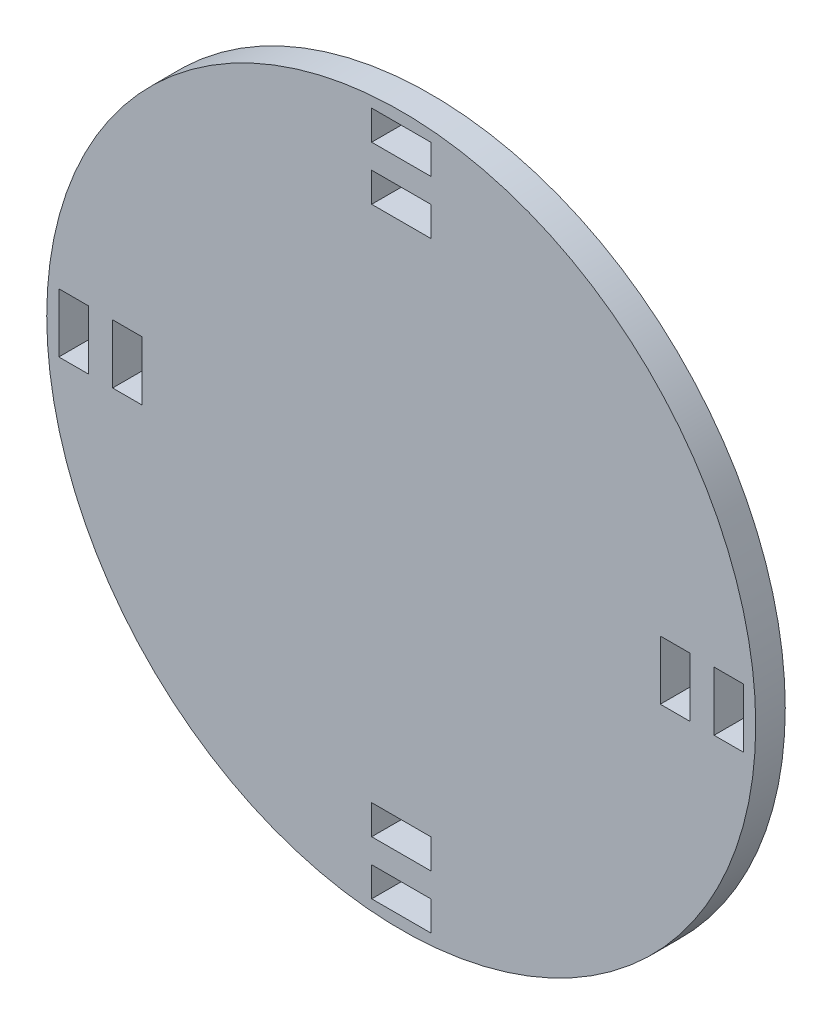
from build123d import *

# Parameters (mm, degrees)
SKETCH1_R           = 76.2
SKETCH1_R_2         = 53.086
BOSS_EXTRUDE2_DEPTH = 6.35
CUT_EXTRUDE1_REACH  = 109.95
SKETCH2_W           = 12.7
SKETCH2_H           = 6.35
CIRPATTERN1_COUNT   = 4
BOSS_EXTRUDE3_START = -6.35
SKETCH3_R           = 53.086
BOSS_EXTRUDE3_DEPTH = 6.35


with BuildPart() as part:
    # Sketch1 → Boss-Extrude2 (new body)
    with BuildSketch(Plane.XY):
        Circle(SKETCH1_R)
        Circle(SKETCH1_R_2, mode=Mode.SUBTRACT)
    extrude(amount=BOSS_EXTRUDE2_DEPTH)

    # Sketch2 → Cut-Extrude1 (cut, up to next)
    with BuildSketch(Plane.XY.offset(6.35), mode=Mode.PRIVATE) as cut_extrude1_sk1:
        with Locations((0, 70.4215)):
            Rectangle(SKETCH2_W, SKETCH2_H)
    cut_extrude1_tool1 = extrude(cut_extrude1_sk1.sketch, amount=-CUT_EXTRUDE1_REACH, mode=Mode.PRIVATE) & part.part
    # Sketch2 → Cut-Extrude1 (cut, up to next)
    with BuildSketch(Plane.XY.offset(6.35), mode=Mode.PRIVATE) as cut_extrude1_sk2:
        with Locations((0, 58.8645)):
            Rectangle(SKETCH2_W, SKETCH2_H)
    cut_extrude1_tool2 = extrude(cut_extrude1_sk2.sketch, amount=-CUT_EXTRUDE1_REACH, mode=Mode.PRIVATE) & part.part
    cut_extrude1_1 = cut_extrude1_tool1.solids().sort_by_distance((0, 70.4215, 6.35))[0]
    add(cut_extrude1_1, mode=Mode.SUBTRACT)
    cut_extrude1_2 = cut_extrude1_tool2.solids().sort_by_distance((0, 58.8645, 6.35))[0]
    add(cut_extrude1_2, mode=Mode.SUBTRACT)
    cut_extrude1 = cut_extrude1_1 + cut_extrude1_2  # Cut-Extrude1 as one shape, for the pattern or mirror that repeats it

    # CirPattern1: Cut-Extrude1 ×4 about axis
    cirpattern1_axis = Axis((0, 0, 0), (0, 0, 1))
    for i in range(1, CIRPATTERN1_COUNT):
        add(cut_extrude1.rotate(cirpattern1_axis, i * 360 / CIRPATTERN1_COUNT), mode=Mode.SUBTRACT)

    # Sketch3 → Boss-Extrude3 (add)
    with BuildSketch(Plane.XY.offset(6.35).offset(BOSS_EXTRUDE3_START)):
        Circle(SKETCH3_R)
    extrude(amount=BOSS_EXTRUDE3_DEPTH)


solid = part.part
